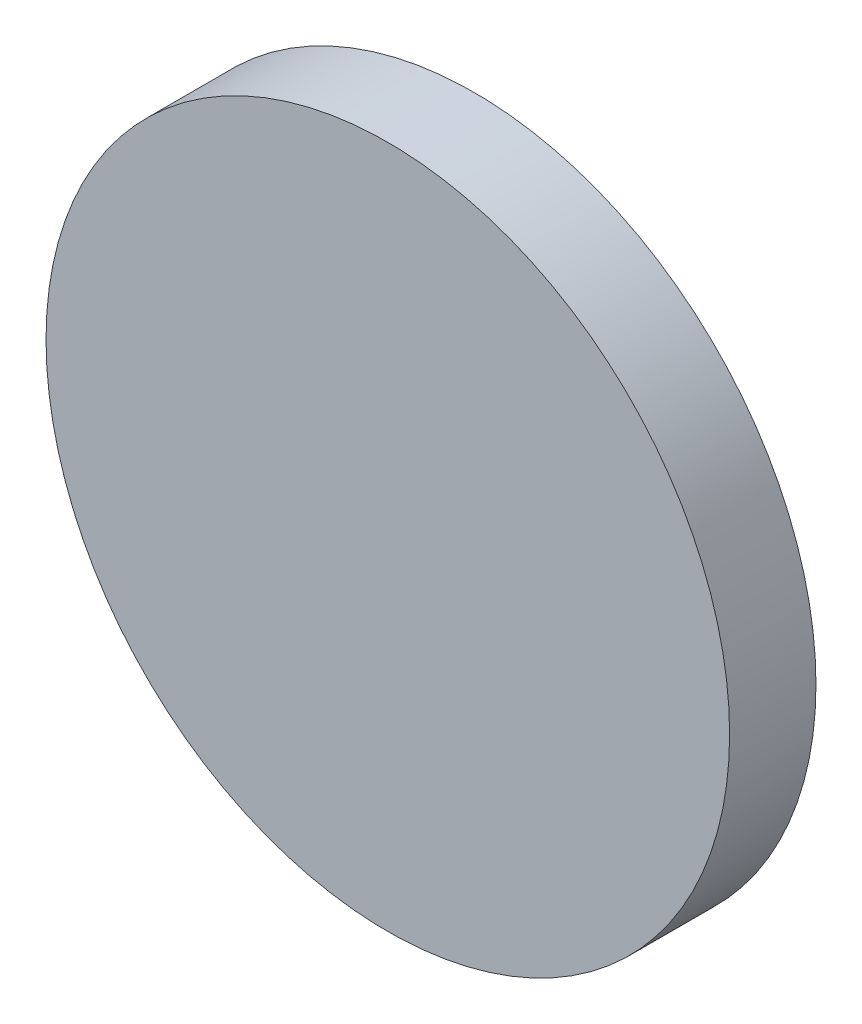
from build123d import *

# Parameters (mm, degrees)
SKETCH3_R           = 47.5
BOSS_EXTRUDE2_DEPTH = 12


with BuildPart() as part:
    # Sketch3 → Boss-Extrude2 (new body)
    with BuildSketch(Plane.XY):
        Circle(SKETCH3_R)
    extrude(amount=BOSS_EXTRUDE2_DEPTH)


solid = part.part
